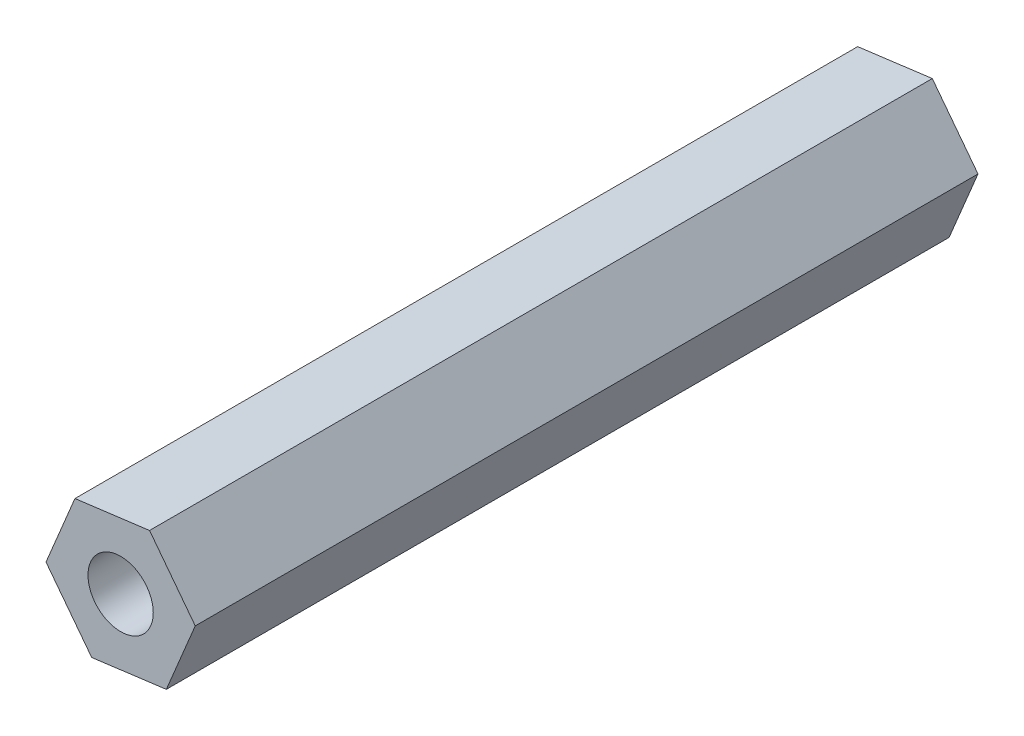
from build123d import *

# Parameters (mm, degrees)
SKETCH1_R           = 3.18
BOSS_EXTRUDE1_DEPTH = 76.27


with BuildPart() as part:
    # Sketch1 → Boss-Extrude1 (new body)
    with BuildSketch(Plane.XY):
        Polygon((7.271508307, 0.942602929), (2.819436071, 6.768612382), (-4.452072235, 5.826009453), (-7.271508307, -0.942602929), (-2.819436071, -6.768612382), (4.452072235, -5.826009453), align=None)
        Circle(SKETCH1_R, mode=Mode.SUBTRACT)
    extrude(amount=BOSS_EXTRUDE1_DEPTH)


solid = part.part
